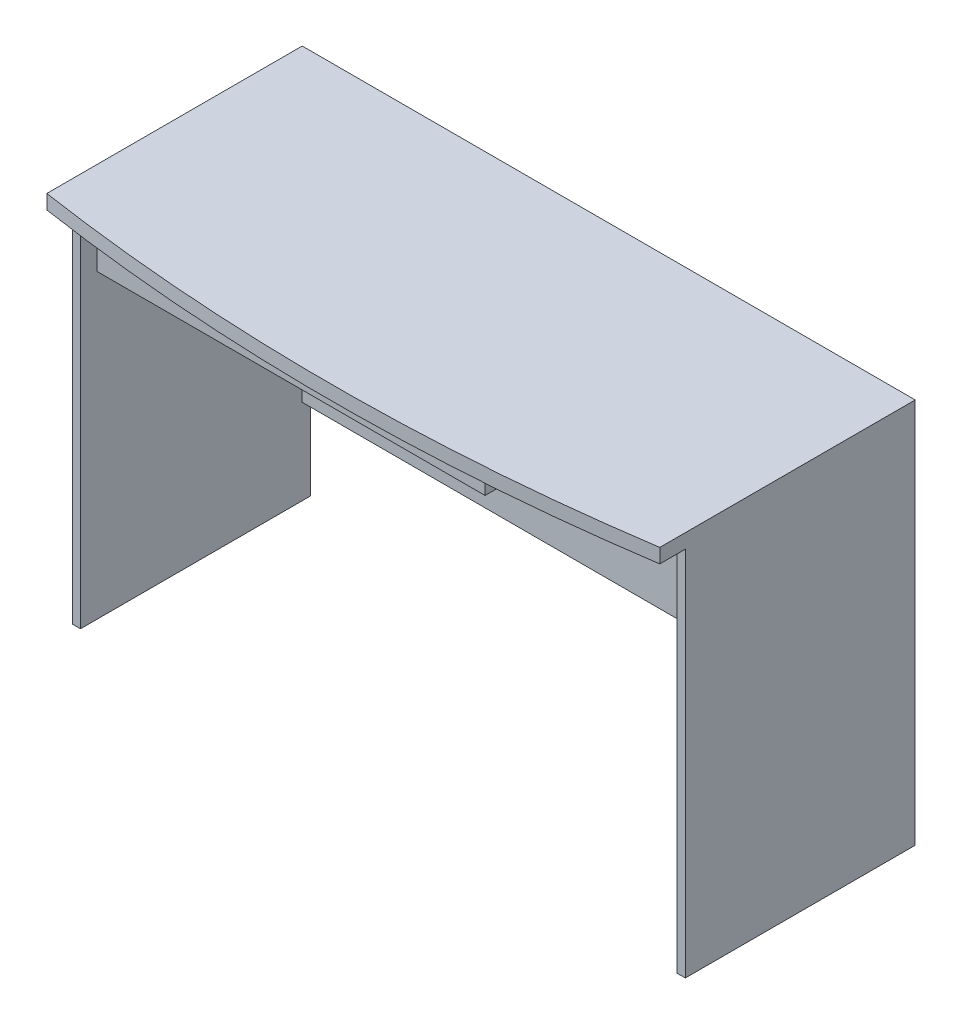
from build123d import *

# Parameters (mm, degrees)
BOSS_EXTRUDE1_DEPTH = 28
SKETCH2_W           = 16
SKETCH2_H           = 450
BOSS_EXTRUDE2_DEPTH = 727
SKETCH3_W           = 16
SKETCH3_H           = 300
BOSS_EXTRUDE3_DEPTH = 1168
SKETCH4_W           = 760
SKETCH4_H           = 430
BOSS_EXTRUDE4_DEPTH = 70


with BuildPart() as part:
    # Sketch1 → Boss-Extrude1 (new body)
    with BuildSketch(Plane(origin=(0, 0, 0), x_dir=(1, 0, 0), z_dir=(0, 1, 0))):
        with BuildLine():
            Line((-600, -250), (-600, 250))
            Line((-600, 250), (600, 250))
            Line((600, 250), (600, -250))
            ThreePointArc((600, -250), (0, -295), (-600, -250))
        make_face()
    extrude(amount=BOSS_EXTRUDE1_DEPTH)

    # Sketch2 → Boss-Extrude2 (add)
    with BuildSketch(Plane.XZ):
        with Locations((-592, -25)):
            Rectangle(SKETCH2_W, SKETCH2_H)
    boss_extrude2 = extrude(amount=BOSS_EXTRUDE2_DEPTH)

    # Mirror1: Boss-Extrude2 across plane
    add(boss_extrude2.mirror(Plane(origin=(0, 0, 0), x_dir=(0, 0, 1), z_dir=(1, 0, 0))))

    # Sketch3 → Boss-Extrude3 (add)
    with BuildSketch(Plane(origin=(-584, 0, 0), x_dir=(0, 0, -1), z_dir=(1, 0, 0))):
        with Locations((242, -410)):
            Rectangle(SKETCH3_W, SKETCH3_H)
    extrude(amount=BOSS_EXTRUDE3_DEPTH)

    # Sketch4 → Boss-Extrude4 (add)
    with BuildSketch(Plane.XZ):
        with Locations((-137, 20)):
            Rectangle(SKETCH4_W, SKETCH4_H)
    extrude(amount=BOSS_EXTRUDE4_DEPTH)


solid = part.part
